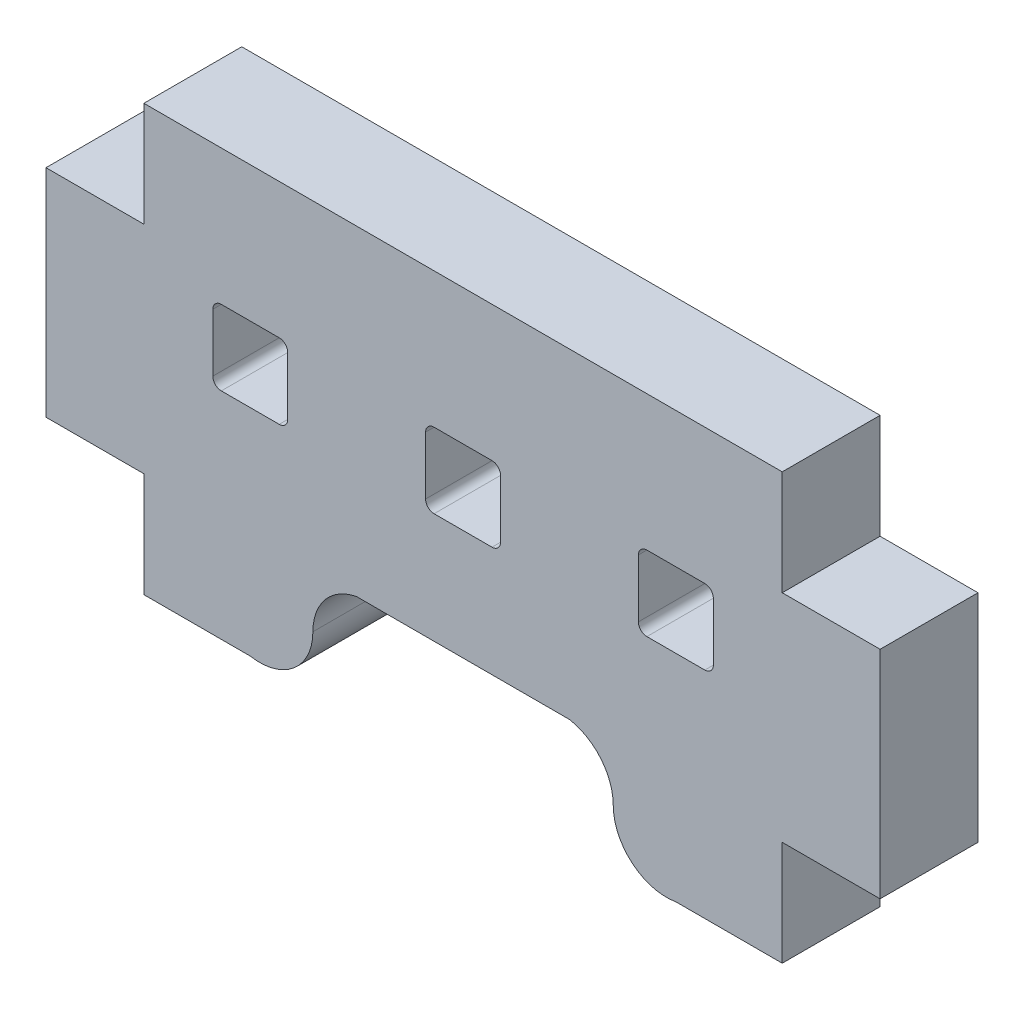
from build123d import *

# Parameters (mm, degrees)
BOSS_EXTRUDE1_DEPTH = 5.842


with BuildPart() as part:
    # Sketch1 → Boss-Extrude1 (new body)
    with BuildSketch(Plane.XY):
        with BuildLine():
            Line((0, 0), (-6.35, 0))
            ThreePointArc((-6.35, 0), (-8.948239117, 0.689575054), (-10.086248608, 3.125))
            ThreePointArc((-10.086248608, 3.125), (-10.825823663, 5.161990509), (-12.7, 6.25))
            Line((-12.7, 6.25), (-25.4, 6.25))
            ThreePointArc((-25.4, 6.25), (-27.274176337, 5.161990509), (-28.013751392, 3.125))
            ThreePointArc((-28.013751392, 3.125), (-29.151760883, 0.689575054), (-31.75, 0))
            Line((-31.75, 0), (-38.1, 0))
            Line((-38.1, 0), (-38.1, 6.25))
            Line((-38.1, 6.25), (-43.942, 6.25))
            Line((-43.942, 6.25), (-43.942, 19.15))
            Line((-43.942, 19.15), (-38.1, 19.15))
            Line((-38.1, 19.15), (-38.1, 25.4))
            Line((-38.1, 25.4), (0, 25.4))
            Line((0, 25.4), (0, 19.15))
            Line((0, 19.15), (5.842, 19.15))
            Line((5.842, 19.15), (5.842, 6.25))
            Line((5.842, 6.25), (0, 6.25))
            Line((0, 6.25), (0, 0))
        make_face()
        with BuildLine():
            Line((-4.621403, 12.844653), (-8.078597, 12.844653))
            ThreePointArc((-8.078597, 12.844653), (-8.437807245, 12.993442755), (-8.586597, 13.352653))
            Line((-8.586597, 13.352653), (-8.586597, 16.809847))
            ThreePointArc((-8.586597, 16.809847), (-8.437807245, 17.169057245), (-8.078597, 17.317847))
            Line((-8.078597, 17.317847), (-4.621403, 17.317847))
            ThreePointArc((-4.621403, 17.317847), (-4.262192755, 17.169057245), (-4.113403, 16.809847))
            Line((-4.113403, 16.809847), (-4.113403, 13.352653))
            ThreePointArc((-4.113403, 13.352653), (-4.262192755, 12.993442755), (-4.621403, 12.844653))
        make_face(mode=Mode.SUBTRACT)
        with BuildLine():
            Line((-16.813403, 13.352653), (-16.813403, 16.809847))
            ThreePointArc((-16.813403, 16.809847), (-16.962192755, 17.169057245), (-17.321403, 17.317847))
            Line((-17.321403, 17.317847), (-20.778597, 17.317847))
            ThreePointArc((-20.778597, 17.317847), (-21.137807245, 17.169057245), (-21.286597, 16.809847))
            Line((-21.286597, 16.809847), (-21.286597, 13.352653))
            ThreePointArc((-21.286597, 13.352653), (-21.137807245, 12.993442755), (-20.778597, 12.844653))
            Line((-20.778597, 12.844653), (-17.321403, 12.844653))
            ThreePointArc((-17.321403, 12.844653), (-16.962192755, 12.993442755), (-16.813403, 13.352653))
        make_face(mode=Mode.SUBTRACT)
        with BuildLine():
            Line((-29.513403, 13.352653), (-29.513403, 16.809847))
            ThreePointArc((-29.513403, 16.809847), (-29.662192755, 17.169057245), (-30.021403, 17.317847))
            Line((-30.021403, 17.317847), (-33.478597, 17.317847))
            ThreePointArc((-33.478597, 17.317847), (-33.837807245, 17.169057245), (-33.986597, 16.809847))
            Line((-33.986597, 16.809847), (-33.986597, 13.352653))
            ThreePointArc((-33.986597, 13.352653), (-33.837807245, 12.993442755), (-33.478597, 12.844653))
            Line((-33.478597, 12.844653), (-30.021403, 12.844653))
            ThreePointArc((-30.021403, 12.844653), (-29.662192755, 12.993442755), (-29.513403, 13.352653))
        make_face(mode=Mode.SUBTRACT)
    extrude(amount=BOSS_EXTRUDE1_DEPTH)


solid = part.part
